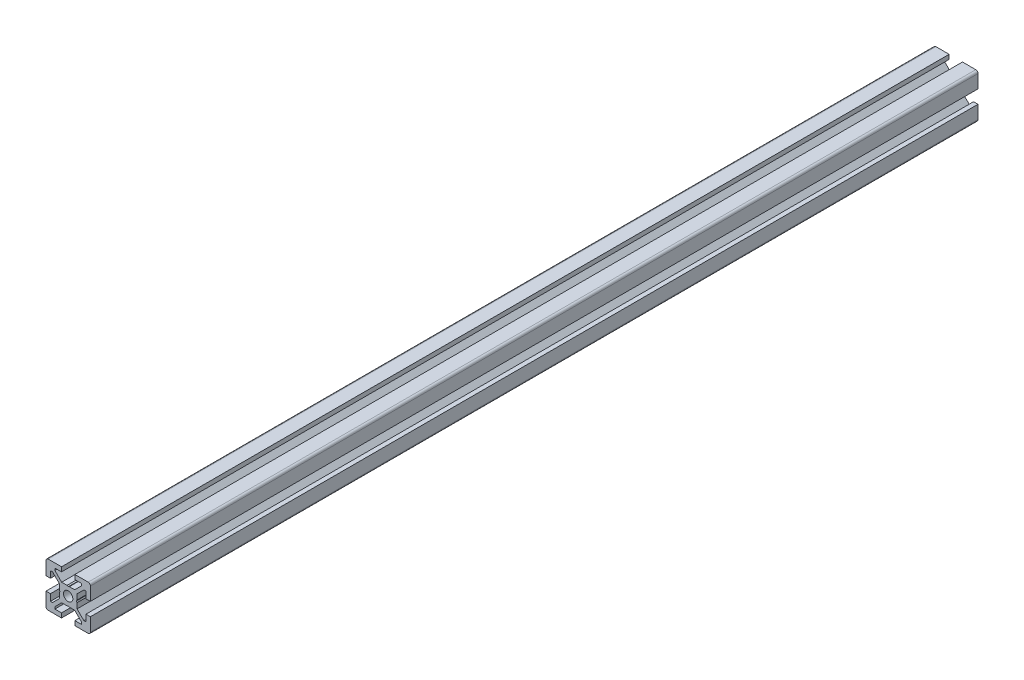
from build123d import *

# Parameters (mm, degrees)
BOSS_EXTRUDE1_DEPTH = 400
SKETCH2_W           = 400
SKETCH2_H           = 2.1


with BuildPart() as part:
    # Sketch1 → Boss-Extrude1 (new body)
    with BuildSketch(Plane.XY):
        with BuildLine():
            Line((-10, -3), (-10, -9))
            ThreePointArc((-10, -9), (-9.707106781, -9.707106781), (-9, -10))
            Line((-9, -10), (-3, -10))
            Line((-3, -10), (-3, -8))
            Line((-3, -8), (-6, -8))
            Line((-6, -8), (-6, -7.060660172))
            Line((-6, -7.060660172), (-2.939339828, -4))
            Line((-2.939339828, -4), (-0.519615242, -4))
            Line((-0.519615242, -4), (0, -3.7))
            Line((0, -3.7), (0.519615242, -4))
            Line((0.519615242, -4), (2.939339828, -4))
            Line((2.939339828, -4), (6, -7.060660172))
            Line((6, -7.060660172), (6, -8))
            Line((6, -8), (3, -8))
            Line((3, -8), (3, -10))
            Line((3, -10), (9, -10))
            ThreePointArc((9, -10), (9.707106781, -9.707106781), (10, -9))
            Line((10, -9), (10, -3))
            Line((10, -3), (8, -3))
            Line((8, -3), (8, -6))
            Line((8, -6), (7.060660172, -6))
            Line((7.060660172, -6), (4, -2.939339828))
            Line((4, -2.939339828), (4, -0.519615242))
            Line((4, -0.519615242), (3.7, 0))
            Line((3.7, 0), (4, 0.519615242))
            Line((4, 0.519615242), (4, 2.939339828))
            Line((4, 2.939339828), (7.060660172, 6))
            Line((7.060660172, 6), (8, 6))
            Line((8, 6), (8, 3))
            Line((8, 3), (10, 3))
            Line((10, 3), (10, 9))
            ThreePointArc((10, 9), (9.707106781, 9.707106781), (9, 10))
            Line((9, 10), (3, 10))
            Line((3, 10), (3, 8))
            Line((3, 8), (6, 8))
            Line((6, 8), (6, 7.060660172))
            Line((6, 7.060660172), (2.939339828, 4))
            Line((2.939339828, 4), (0.519615242, 4))
            Line((0.519615242, 4), (0, 3.7))
            Line((0, 3.7), (-0.519615242, 4))
            Line((-0.519615242, 4), (-2.939339828, 4))
            Line((-2.939339828, 4), (-6, 7.060660172))
            Line((-6, 7.060660172), (-6, 8))
            Line((-6, 8), (-3, 8))
            Line((-3, 8), (-3, 10))
            Line((-3, 10), (-9, 10))
            ThreePointArc((-9, 10), (-9.707106781, 9.707106781), (-10, 9))
            Line((-10, 9), (-10, 3))
            Line((-10, 3), (-8, 3))
            Line((-8, 3), (-8, 6))
            Line((-8, 6), (-7.060660172, 6))
            Line((-7.060660172, 6), (-4, 2.939339828))
            Line((-4, 2.939339828), (-4, 0.519615242))
            Line((-4, 0.519615242), (-3.7, 0))
            Line((-3.7, 0), (-4, -0.519615242))
            Line((-4, -0.519615242), (-4, -2.939339828))
            Line((-4, -2.939339828), (-7.060660172, -6))
            Line((-7.060660172, -6), (-8, -6))
            Line((-8, -6), (-8, -3))
            Line((-8, -3), (-10, -3))
        make_face()
    extrude(amount=-BOSS_EXTRUDE1_DEPTH)

    # Sketch2 → Cut-Revolve1 (revolve, cut)
    with BuildSketch(Plane(origin=(0, 0, 0), x_dir=(0, 0, -1), z_dir=(1, 0, 0)), mode=Mode.PRIVATE) as cut_revolve1_sk:
        with Locations((200, 1.05)):
            Rectangle(SKETCH2_W, SKETCH2_H)
    revolve(cut_revolve1_sk.sketch.rotate(Axis((0, 0, -400), (0, 0, 1)), 270), axis=Axis((0, 0, -400), (0, 0, 1)), mode=Mode.SUBTRACT)


solid = part.part
